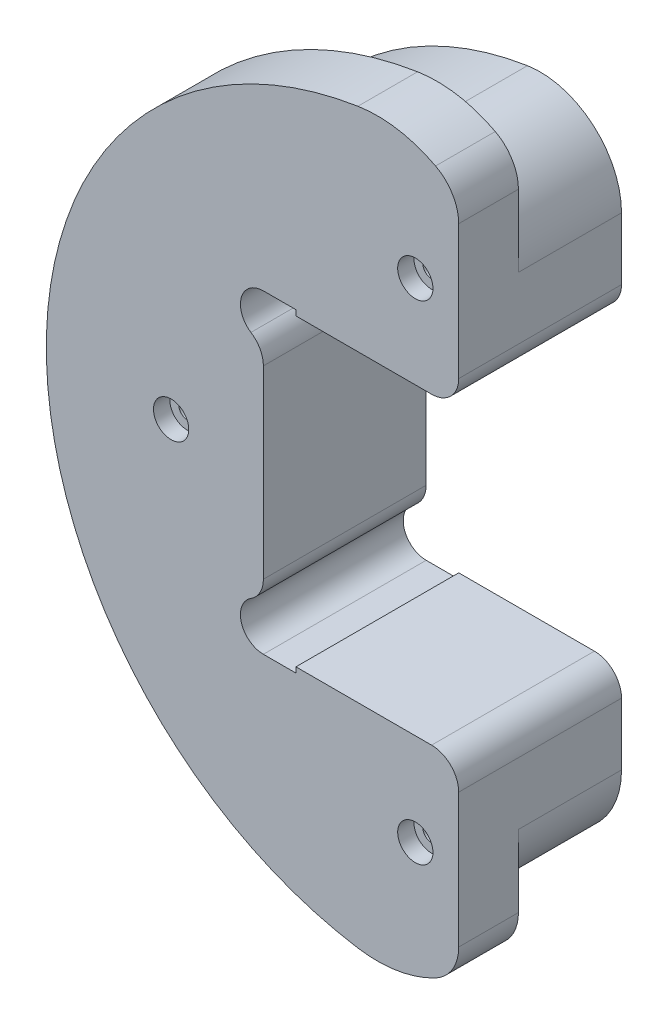
from build123d import *

# Parameters (mm, degrees)
EXTRUDE_1_DEPTH              = 30
HOLE_WIZARD_M3_1_D           = 3.2
HOLE_WIZARD_M3_1_CBORE_D     = 6.5
HOLE_WIZARD_M3_1_CBORE_DEPTH = 3
FILLET_1_R                   = 15
CUT_EXTRUDE_1782_DEPTH       = 90.635744244
FILLET_2_R                   = 5
EXTRUDE_2_DEPTH              = 11
FILLET_3_R                   = 8


with BuildPart() as part:
    # ｽｹｯﾁ1 → ﾎﾞｽ - 押し出し1 (new body)
    with BuildSketch(Plane.XY):
        with BuildLine():
            Line((8, 59.464274989), (8, 28))
            Line((8, 28), (-22, 28))
            Line((-22, 28), (-22, 29))
            Line((-22, 29), (-28, 29))
            Line((-28, 29), (-28, -29))
            Line((-28, -29), (-22, -29))
            Line((-22, -29), (-22, -28))
            Line((-22, -28), (8, -28))
            Line((8, -28), (8, -59.464274989))
            ThreePointArc((8, -59.464274989), (-60, 0), (8, 59.464274989))
        make_face()
    extrude(amount=EXTRUDE_1_DEPTH)

    # M3 穴付きねじ用座ぐり穴1 (through all)
    with Locations(Plane(origin=(0, 45, 30), x_dir=(1, 0, 0), z_dir=(0, 0, 1))):
        with Locations((0, 0), (-45, -45), (0, -90)):
            CounterBoreHole(HOLE_WIZARD_M3_1_D / 2, HOLE_WIZARD_M3_1_CBORE_D / 2, HOLE_WIZARD_M3_1_CBORE_DEPTH)

    # ﾌｨﾚｯﾄ1
    fillet_1_edges = [part.edges().sort_by_distance(p)[0] for p in [
        (8, 59.464274989, 15),
        (8, -59.464274989, 15),
    ]]
    fillet(fillet_1_edges, radius=FILLET_1_R)

    # ｽｹｯﾁ3 → Cut-Extrude 1782 (cut, through all)
    with BuildSketch(Plane.XY):
        with BuildLine():
            Line((-28, 29), (-28, 20.55))
            ThreePointArc((-28, 20.55), (-32.225, 24.775), (-28, 29))
        make_face()
        with BuildLine():
            Line((-28, -29), (-28, -20.55))
            ThreePointArc((-28, -20.55), (-32.225, -24.775), (-28, -29))
        make_face()
    extrude(amount=CUT_EXTRUDE_1782_DEPTH, mode=Mode.SUBTRACT)

    # ﾌｨﾚｯﾄ2
    fillet_2_edges = [part.edges().sort_by_distance(p)[0] for p in [
        (8, 28, 15),
        (8, -28, 15),
        (-28, 20.55, 15),
        (-28, -20.55, 15),
    ]]
    fillet(fillet_2_edges, radius=FILLET_2_R)

    # ｽｹｯﾁ4 → ﾎﾞｽ - 押し出し2 (add)
    with BuildSketch(Plane.XY.offset(30)):
        with BuildLine():
            Line((8, 44.452221542), (8, 61.887817316))
            ThreePointArc((8, 61.887817316), (-0.707298954, 66.574651642), (-10.577777778, 67.172245885))
            ThreePointArc((-10.577777778, 67.172245885), (-68, 0), (-10.577777778, -67.172245885))
            ThreePointArc((-10.577777778, -67.172245885), (-0.707298954, -66.574651642), (8, -61.887817316))
            Line((8, -61.887817316), (8, -44.452221542))
            ThreePointArc((8, -44.452221542), (2.746794345, -55.853975793), (-9.333333333, -59.269628722))
            ThreePointArc((-9.333333333, -59.269628722), (-60, 0), (-9.333333333, 59.269628722))
            ThreePointArc((-9.333333333, 59.269628722), (2.746794345, 55.853975793), (8, 44.452221542))
        make_face()
    extrude(amount=-EXTRUDE_2_DEPTH)

    # ﾌｨﾚｯﾄ3
    fillet_3_edges = [part.edges().sort_by_distance(p)[0] for p in [
        (8, -61.887817316, 24.5),
        (8, 61.887817316, 24.5),
    ]]
    fillet(fillet_3_edges, radius=FILLET_3_R)


solid = part.part
